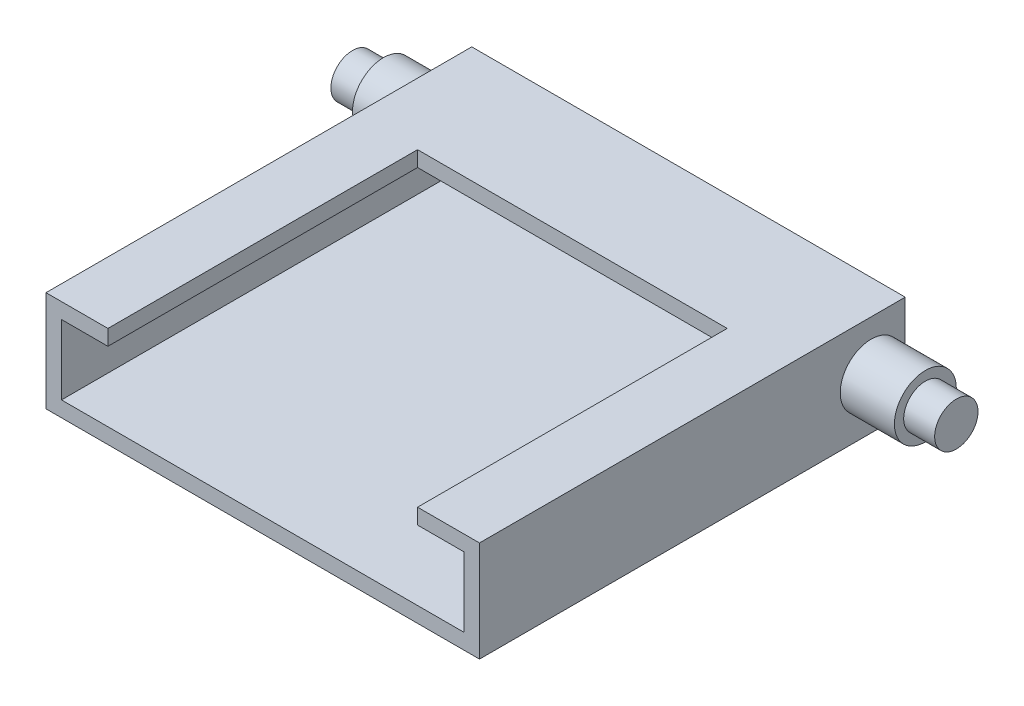
from build123d import *

# Parameters (mm, degrees)
SKETCH1_W           = 71.12
SKETCH1_H           = 69.85
BOSS_EXTRUDE1_DEPTH = 16.51
SHELL1_T            = -2.54
SKETCH4_R           = 5.08
BOSS_EXTRUDE2_DEPTH = 8.89
BOSS_EXTRUDE3_START = 8.89
SKETCH3_R           = 5.08
BOSS_EXTRUDE3_DEPTH = 8.89
SKETCH6_R           = 3.556
BOSS_EXTRUDE4_DEPTH = 5.08
BOSS_EXTRUDE5_START = 5.08
SKETCH5_R           = 3.556
BOSS_EXTRUDE5_DEPTH = 5.08
SKETCH7_W           = 50.8
SKETCH7_H           = 50.8
CUT_EXTRUDE1_DEPTH  = 2.54
SKETCH8_W           = 25.4
SKETCH8_H           = 6.35
CUT_EXTRUDE2_DEPTH  = 2.54


with BuildPart() as part:
    # Sketch1 → Boss-Extrude1 (new body)
    with BuildSketch(Plane(origin=(0, 0, 0), x_dir=(1, 0, 0), z_dir=(0, 1, 0))):
        Rectangle(SKETCH1_W, SKETCH1_H)
    extrude(amount=BOSS_EXTRUDE1_DEPTH)

    # Shell1
    shell1_openings = [part.faces().sort_by_distance(p)[0] for p in [
        (0, 8.255, 34.925),
    ]]
    offset(amount=SHELL1_T, openings=shell1_openings, kind=Kind.INTERSECTION)

    # Sketch4 → Boss-Extrude2 (add)
    with BuildSketch(Plane.ZY.offset(35.56)):
        with Locations(Location((-29.337, 8.255, 0), (0, 0, 180))):
            Circle(SKETCH4_R)
    extrude(amount=BOSS_EXTRUDE2_DEPTH)

    # Sketch3 → Boss-Extrude3 (add)
    with BuildSketch(Plane(origin=(35.56, 0, 0), x_dir=(0, 0, -1), z_dir=(1, 0, 0)).offset(BOSS_EXTRUDE3_START)):
        with Locations((29.337, 8.255)):
            Circle(SKETCH3_R)
    extrude(amount=-BOSS_EXTRUDE3_DEPTH)

    # Sketch6 → Boss-Extrude4 (add)
    with BuildSketch(Plane(origin=(44.45, 0, 0), x_dir=(0, 0, -1), z_dir=(1, 0, 0))):
        with Locations((29.337, 8.255)):
            Circle(SKETCH6_R)
    extrude(amount=BOSS_EXTRUDE4_DEPTH)

    # Sketch5 → Boss-Extrude5 (add)
    with BuildSketch(Plane.ZY.offset(44.45).offset(BOSS_EXTRUDE5_START)):
        with Locations(Location((-29.337, 8.255, 0), (0, 0, 180))):
            Circle(SKETCH5_R)
    extrude(amount=-BOSS_EXTRUDE5_DEPTH)

    # Sketch7 → Cut-Extrude1 (cut)
    with BuildSketch(Plane(origin=(0, 16.51, 0), x_dir=(1, 0, 0), z_dir=(0, 1, 0))):
        with Locations((0, -9.525)):
            Rectangle(SKETCH7_W, SKETCH7_H)
    extrude(amount=-CUT_EXTRUDE1_DEPTH, mode=Mode.SUBTRACT)

    # Sketch8 → Cut-Extrude2 (cut)
    with BuildSketch(Plane(origin=(0, 0, -34.925), x_dir=(-1, 0, 0), z_dir=(0, 0, -1))):
        with Locations((0, 8.255)):
            Rectangle(SKETCH8_W, SKETCH8_H)
    extrude(amount=-CUT_EXTRUDE2_DEPTH, mode=Mode.SUBTRACT)


solid = part.part
